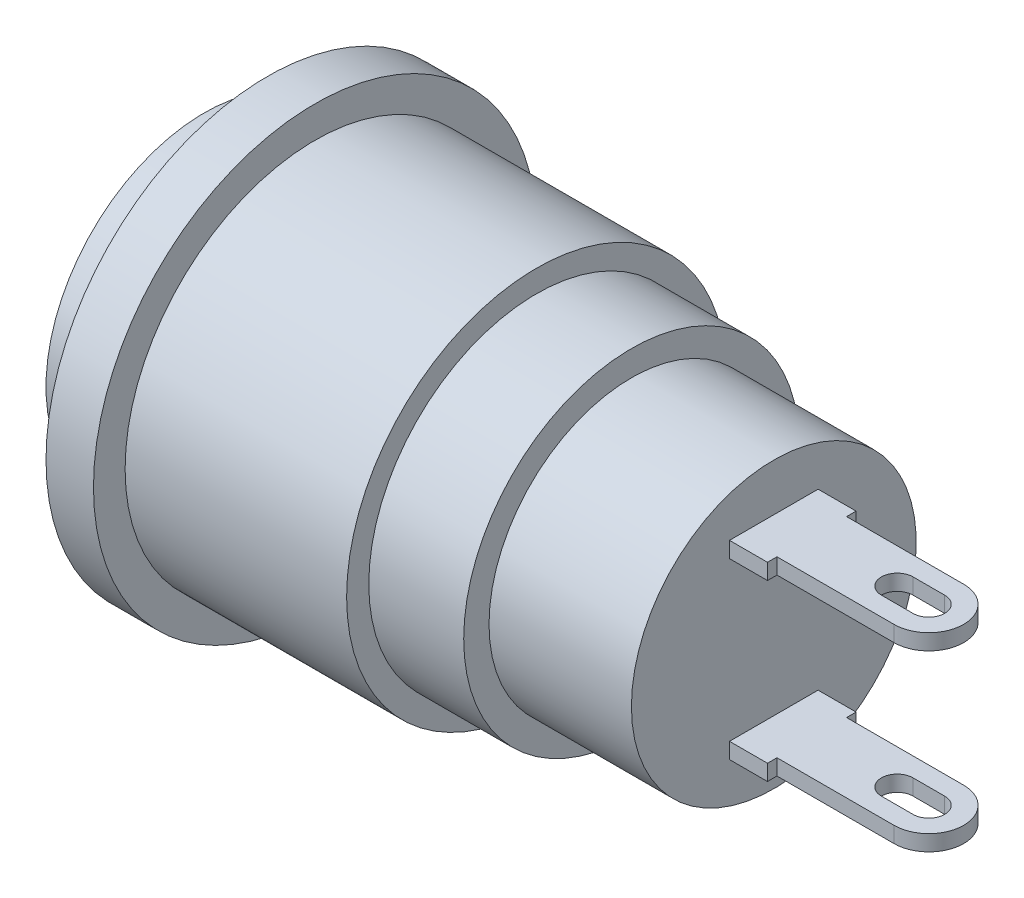
from build123d import *

# Parameters (mm, degrees)
BOSS_EXTRUDE1_DEPTH = 0.5


with BuildPart() as part:
    # Sketch1 → Revolve1 (revolve)
    with BuildSketch(Plane(origin=(0, 0, 0), x_dir=(1, 0, 0), z_dir=(0, 1, 0)), mode=Mode.PRIVATE) as revolve1_sk:
        Polygon((-8, 0), (8, 0), (8, 4.5), (3.5, 4.5), (3.5, 5.3), (0.5, 5.3), (0.5, 6), (-6.5, 6), (-6.5, 7), (-8, 7), align=None)
    revolve(revolve1_sk.sketch.rotate(Axis((-8, 0, 0), (1, 0, 0)), 180), axis=Axis((-8, 0, 0), (1, 0, 0)))

    # Sketch2 → Revolve2 (revolve)
    with BuildSketch(Plane(origin=(0, 0, 0), x_dir=(1, 0, 0), z_dir=(0, 1, 0))):
        with BuildLine():
            Line((-8, 0), (-11, 0))
            add(Edge.make_bspline(
                [(-11, 0), (-11, 2.651487421), (-10, 5)],
                knots=[0, 0, 0, 1, 1, 1], degree=2))
            Line((-10, 5), (-8, 5))
            Line((-8, 5), (-8, 0))
        make_face()
    revolve(axis=Axis((-8, 0, 0), (-1, 0, 0)))

    # Sketch3 → Boss-Extrude1 (add)
    with BuildSketch(Plane(origin=(0, 3, 0), x_dir=(1, 0, 0), z_dir=(0, 1, 0))):
        with BuildLine():
            Line((8, -1.4), (8, 1.4))
            Line((8, 1.4), (9.2, 1.4))
            Line((9.2, 1.4), (9.2, 1.1))
            Line((9.2, 1.1), (12.9, 1.1))
            ThreePointArc((12.9, 1.1), (14, 0), (12.9, -1.1))
            Line((12.9, -1.1), (9.2, -1.1))
            Line((9.2, -1.1), (9.2, -1.4))
            Line((9.2, -1.4), (8, -1.4))
        make_face()
        with BuildLine():
            Line((11.9, 0.5), (12.9, 0.5))
            ThreePointArc((12.9, 0.5), (13.4, 0), (12.9, -0.5))
            Line((12.9, -0.5), (11.9, -0.5))
            ThreePointArc((11.9, -0.5), (11.4, 0), (11.9, 0.5))
        make_face(mode=Mode.SUBTRACT)
    boss_extrude1 = extrude(amount=-BOSS_EXTRUDE1_DEPTH)

    # Mirror1: Boss-Extrude1 across plane
    add(boss_extrude1.mirror(Plane.ZX))


solid = part.part
